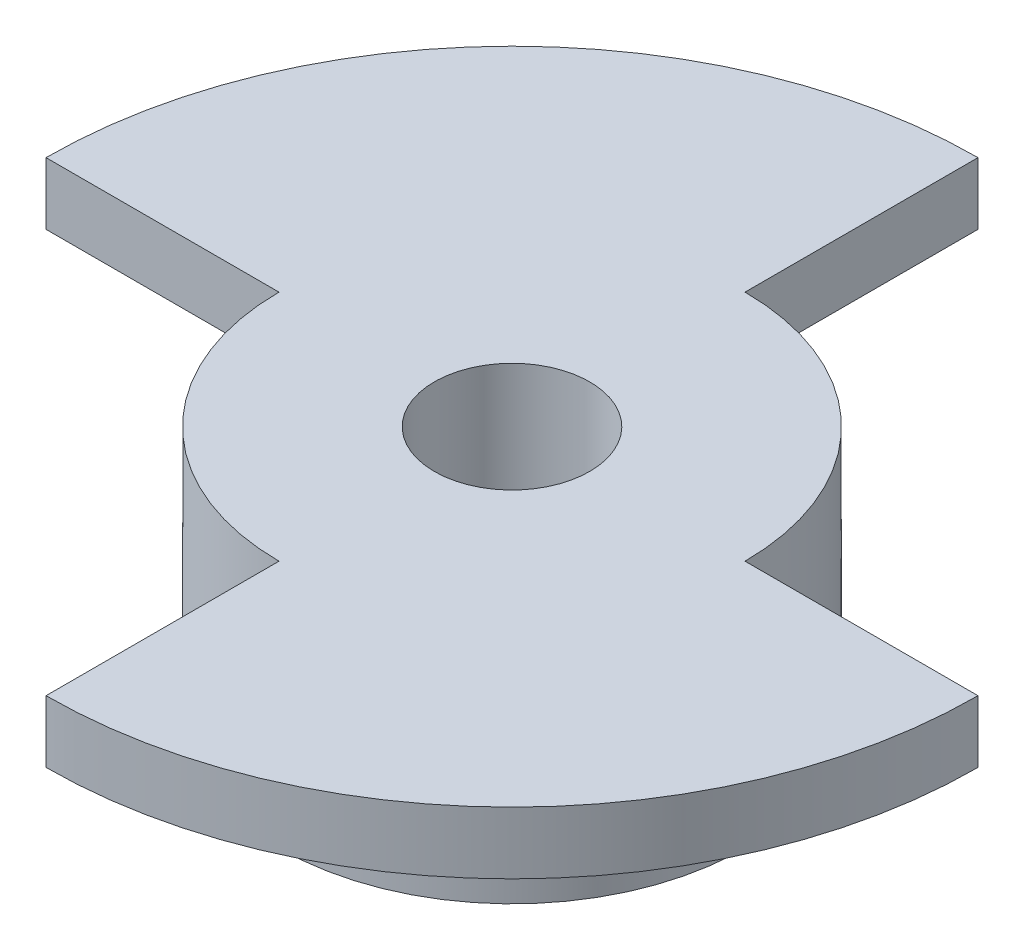
from build123d import *
from build123d.topology import SkipClean

# Parameters (mm, degrees)
CUT_EXTRUDE1_DEPTH = 23.045407685


with BuildPart() as part:
    # Sketch1 → Revolve1 (revolve)
    with BuildSketch(Plane.XY, mode=Mode.PRIVATE) as revolve1_sk:
        Polygon((2.5, 0), (7.5, 0), (7.5, 6), (15, 6), (15, 8), (2.5, 8), align=None)
    revolve(revolve1_sk.sketch.rotate(Axis((0, 24.642857143, 0), (0, -1, 0)), 90), axis=Axis((0, 24.642857143, 0), (0, -1, 0)))

    # Sketch2 → Cut-Extrude1 (cut, through all)
    with SkipClean():  # the faces are left unmerged after this step: merging them gives an invalid solid
        with BuildSketch(Plane.XZ.offset(-6)):
            with BuildLine():
                Line((0, 7.5), (0, 23.487072106))
                Line((0, 23.487072106), (-23.487072106, 0))
                Line((-23.487072106, 0), (-7.5, 0))
                ThreePointArc((-7.5, 0), (-5.303300859, 5.303300859), (0, 7.5))
            make_face()
            with BuildLine():
                Line((7.5, 0), (23.235513735, 0))
                Line((23.235513735, 0), (0, -21.944820016))
                Line((0, -21.944820016), (0, -7.5))
                ThreePointArc((0, -7.5), (5.303300859, -5.303300859), (7.5, 0))
            make_face()
        extrude(amount=-CUT_EXTRUDE1_DEPTH, mode=Mode.SUBTRACT)


solid = part.part
